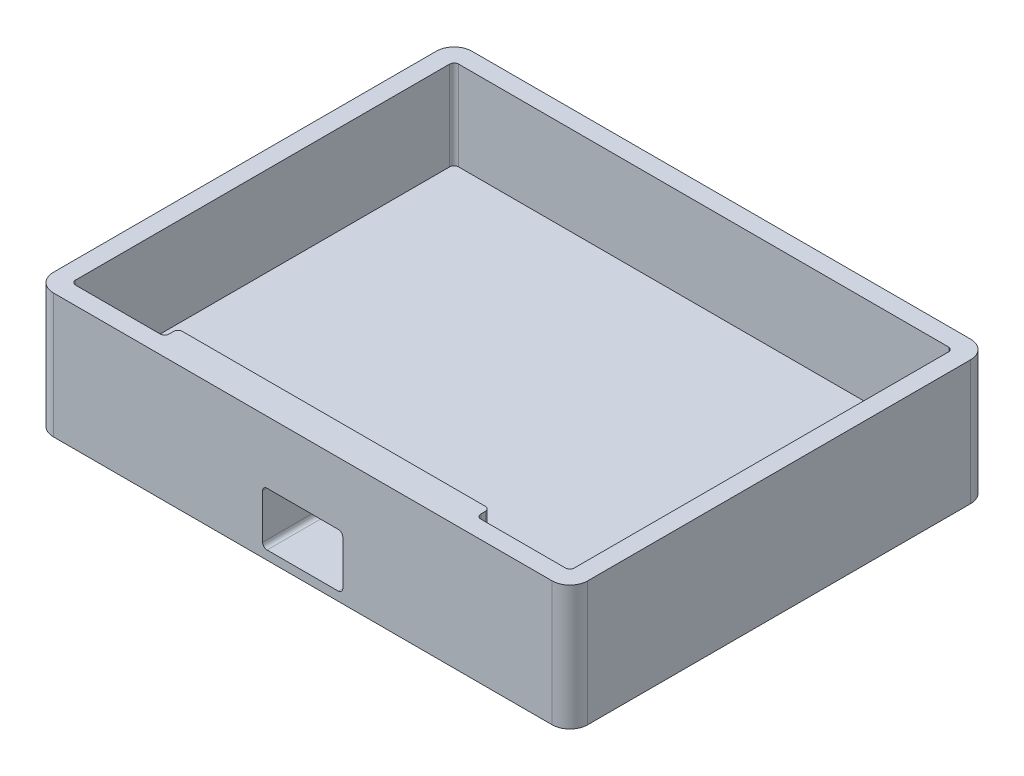
from build123d import *

# Parameters (mm, degrees)
SKETCH1_W               = 60
SKETCH1_H               = 47
BOSS_EXTRUDE1_DEPTH     = 4
SKETCH2_W               = 60
SKETCH2_H               = 47
SKETCH2_W_2             = 56
SKETCH2_H_2             = 43
BOSS_EXTRUDE2_DEPTH     = 10
SKETCH4_W               = 35
SKETCH4_H               = 12
BOSS_EXTRUDE3_DEPTH     = 1.5
CUT_EXTRUDE1_DEPTH      = 3
CUT_EXTRUDE1_DEPTH_BACK = 3
SKETCH5_W               = 9
SKETCH5_H               = 8
FILLET1_R               = 2
FILLET2_R               = 0.5
FILLET3_R               = 0.5


with BuildPart() as part:
    # Sketch1 → Boss-Extrude1 (new body)
    with BuildSketch(Plane(origin=(0, 0, 0), x_dir=(1, 0, 0), z_dir=(0, 1, 0))):
        Rectangle(SKETCH1_W, SKETCH1_H)
    extrude(amount=BOSS_EXTRUDE1_DEPTH)

    # Sketch2 → Boss-Extrude2 (add)
    with BuildSketch(Plane(origin=(0, 4, 0), x_dir=(1, 0, 0), z_dir=(0, 1, 0))):
        Rectangle(SKETCH2_W, SKETCH2_H)
        Rectangle(SKETCH2_W_2, SKETCH2_H_2, mode=Mode.SUBTRACT)
    extrude(amount=BOSS_EXTRUDE2_DEPTH)

    # Sketch4 → Boss-Extrude3 (add)
    with BuildSketch(Plane(origin=(0, 0, 21.5), x_dir=(-1, 0, 0), z_dir=(0, 0, -1))):
        with Locations((0, 8)):
            Rectangle(SKETCH4_W, SKETCH4_H)
    extrude(amount=BOSS_EXTRUDE3_DEPTH)

    # Sketch5 → Cut-Extrude1 (cut, two sides: drawn at the far end of the back side and taken through both)
    with BuildSketch(Plane(origin=(0, 4, 0), x_dir=(1, 0, 0), z_dir=(0, 1, 0)).offset(-CUT_EXTRUDE1_DEPTH_BACK)):
        with Locations((0, -19.5)):
            Rectangle(SKETCH5_W, SKETCH5_H)
    extrude(amount=CUT_EXTRUDE1_DEPTH + CUT_EXTRUDE1_DEPTH_BACK, mode=Mode.SUBTRACT)

    # Fillet1
    fillet1_edges = [part.edges().sort_by_distance(p)[0] for p in [
        (30, 7, 23.5),
        (-30, 7, 23.5),
        (-30, 7, -23.5),
        (30, 7, -23.5),
    ]]
    fillet(fillet1_edges, radius=FILLET1_R)

    # Fillet2
    fillet2_edges = [part.edges().sort_by_distance(p)[0] for p in [
        (28, 9, -21.5),
        (-28, 9, -21.5),
        (-28, 9, 21.5),
        (28, 9, 21.5),
        (-17.5, 9, 21.5),
        (17.5, 9, 21.5),
        (17.5, 9, 20),
        (-17.5, 9, 20),
    ]]
    fillet(fillet2_edges, radius=FILLET2_R)

    # Fillet3
    fillet3_edges = [part.edges().sort_by_distance(p)[0] for p in [
        (4.5, 1, 19.5),
        (-4.5, 1, 19.5),
        (4.5, 7, 21.75),
        (-4.5, 7, 21.75),
    ]]
    fillet(fillet3_edges, radius=FILLET3_R)


solid = part.part
